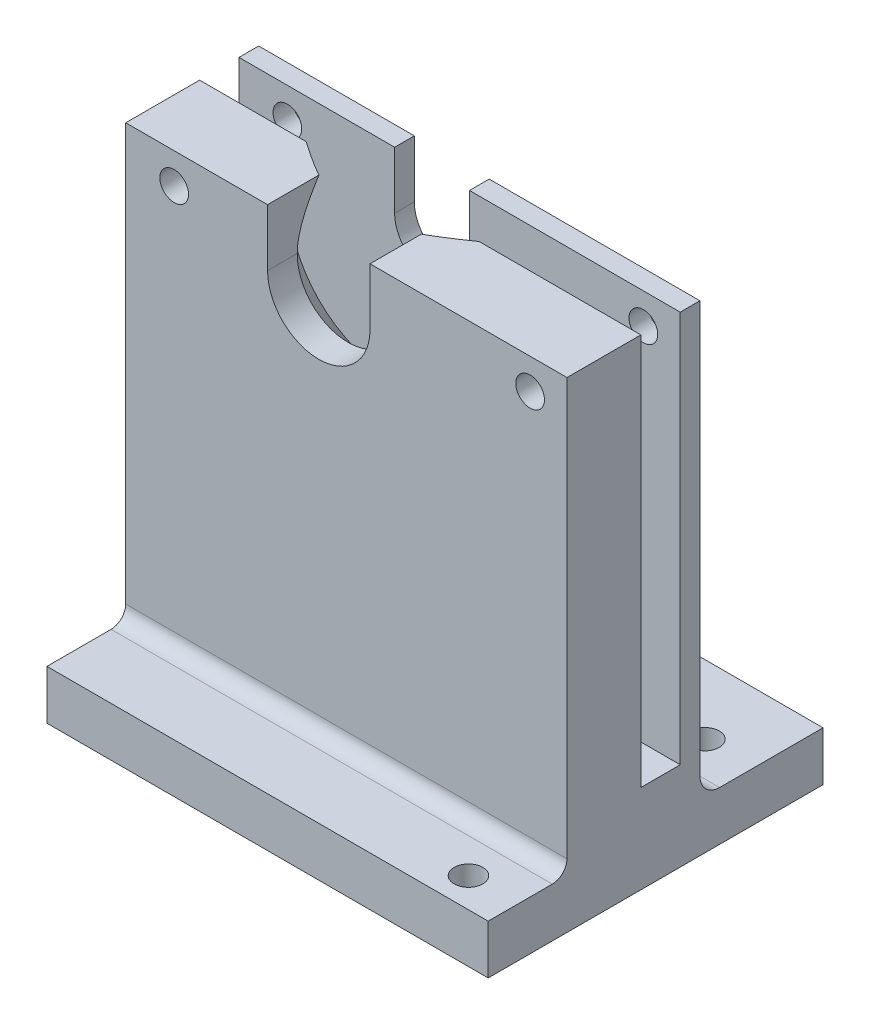
from build123d import *

# Parameters (mm, degrees)
SKETCH1_W                       = 56.896
SKETCH1_H                       = 9.525
BOSS_EXTRUDE1_DEPTH             = 61.976
SKETCH2_R                       = 13.3985
CUT_EXTRUDE1_DEPTH              = 5.8801
CUT_EXTRUDE1_DRAFT              = -50
SKETCH5_W                       = 56.896
SKETCH5_H                       = 11.43
BOSS_EXTRUDE2_DEPTH             = 7.62
TAP_DRILL_FOR_M3X0_5_TAP3_D     = 2.5
TAP_DRILL_FOR_M3X0_5_TAP3_DEPTH = 25.4
TAP_DRILL_FOR_M3X0_5_TAP3_TIP   = 0.751075774
BOSS_EXTRUDE4_DEPTH             = 56.896
M3_CLEARANCE_HOLE3_D            = 3.7
M3_CLEARANCE_HOLE3_DEPTH        = 25.4
M3_CLEARANCE_HOLE3_TIP          = 1.111592145
SKETCH6_W                       = 56.896
SKETCH6_H                       = 2.54
BOSS_EXTRUDE5_DEPTH             = 50.546
SKETCH24_R                      = 4.826
CUT_EXTRUDE2_DEPTH              = 2.54
SKETCH25_R                      = 6.604
CUT_EXTRUDE3_DEPTH              = 7.366
M3_CLEARANCE_HOLE4_D            = 3.7
M3_CLEARANCE_HOLE4_DEPTH        = 17.272
M3_CLEARANCE_HOLE4_TIP          = 1.111592145


with BuildPart() as part:
    # Sketch1 → Boss-Extrude1 (new body)
    with BuildSketch(Plane(origin=(0, 0, 0), x_dir=(1, 0, 0), z_dir=(0, 1, 0))):
        with Locations((9.398, 0)):
            Rectangle(SKETCH1_W, SKETCH1_H)
    extrude(amount=BOSS_EXTRUDE1_DEPTH)


with BuildPart() as cut_extrude1_tool:
    # Sketch2 → Cut-Extrude1 (with draft: the straight prism first)
    with BuildSketch(Plane(origin=(0, 0, -4.7625), x_dir=(-1, 0, 0), z_dir=(0, 0, -1))):
        with Locations((-5.842, 54.552080914)):
            Circle(SKETCH2_R)
    extrude(amount=-CUT_EXTRUDE1_DEPTH)
    # Cut-Extrude1: the draft: its side faces are tilted about the plane it starts from
    cut_extrude1_sides = [cut_extrude1_tool.faces().sort_by_distance(p)[0] for p in [
        (19.2405, 54.552080914, -1.82245),
    ]]
    draft(cut_extrude1_sides, Plane(origin=(0, 0, -4.7625), x_dir=(-1, 0, 0), z_dir=(0, 0, -1)), CUT_EXTRUDE1_DRAFT)


with BuildPart() as part_1:
    add(part.part)

    # Cut-Extrude1: cut by cut_extrude1_tool
    add(cut_extrude1_tool.part, mode=Mode.SUBTRACT)

    # Sketch5 → Boss-Extrude2 (add)
    with BuildSketch(Plane(origin=(0, 0, -4.7625), x_dir=(-1, 0, 0), z_dir=(0, 0, -1))):
        with Locations((-9.398, 5.715)):
            Rectangle(SKETCH5_W, SKETCH5_H)
    extrude(amount=BOSS_EXTRUDE2_DEPTH)

    # Tap Drill for M3x0.5 Tap3
    with Locations(Plane(origin=(0, 11.43, 0), x_dir=(1, 0, 0), z_dir=(0, 1, 0))):
        with Locations((31.496, 7.3025)):
            Hole(TAP_DRILL_FOR_M3X0_5_TAP3_D / 2, depth=TAP_DRILL_FOR_M3X0_5_TAP3_DEPTH)
            with Locations((0, 0, -(TAP_DRILL_FOR_M3X0_5_TAP3_DEPTH + TAP_DRILL_FOR_M3X0_5_TAP3_TIP / 2))):  # 118° drill point
                Cone(0, TAP_DRILL_FOR_M3X0_5_TAP3_D / 2, TAP_DRILL_FOR_M3X0_5_TAP3_TIP, mode=Mode.SUBTRACT)

    # Sketch19 → Boss-Extrude4 (add)
    with BuildSketch(Plane(origin=(37.846, 0, 0), x_dir=(0, 0, -1), z_dir=(1, 0, 0))):
        with BuildLine():
            Line((12.3825, 8.89), (12.3825, 0))
            Line((12.3825, 0), (28.2575, 0))
            Line((28.2575, 0), (28.2575, 6.35))
            Line((28.2575, 6.35), (14.9225, 6.35))
            ThreePointArc((14.9225, 6.35), (13.126448776, 7.093948776), (12.3825, 8.89))
        make_face()
        with BuildLine():
            Line((-14.9225, 0), (-4.7625, 0))
            Line((-4.7625, 0), (-4.7625, 8.2423))
            ThreePointArc((-4.7625, 8.2423), (-5.316741838, 6.904241838), (-6.6548, 6.35))
            Line((-6.6548, 6.35), (-14.9225, 6.35))
            Line((-14.9225, 6.35), (-14.9225, 0))
        make_face()
    extrude(amount=-BOSS_EXTRUDE4_DEPTH)

    # M3 Clearance Hole3
    with Locations(Plane(origin=(0, 0, 0), x_dir=(-1, 0, 0), z_dir=(0, -1, 0))):
        with Locations((-31.496, -11.1125), (-31.496, 19.3675)):
            Hole(M3_CLEARANCE_HOLE3_D / 2, depth=M3_CLEARANCE_HOLE3_DEPTH)
            with Locations((0, 0, -(M3_CLEARANCE_HOLE3_DEPTH + M3_CLEARANCE_HOLE3_TIP / 2))):  # 118° drill point
                Cone(0, M3_CLEARANCE_HOLE3_D / 2, M3_CLEARANCE_HOLE3_TIP, mode=Mode.SUBTRACT)

    # Sketch6 → Boss-Extrude5 (add)
    with BuildSketch(Plane(origin=(0, 11.43, 0), x_dir=(1, 0, 0), z_dir=(0, 1, 0))):
        with Locations((9.398, 11.1125)):
            Rectangle(SKETCH6_W, SKETCH6_H)
    extrude(amount=BOSS_EXTRUDE5_DEPTH)

    # Sketch24 → Cut-Extrude2 (cut)
    with BuildSketch(Plane(origin=(0, 0, -12.3825), x_dir=(-1, 0, 0), z_dir=(0, 0, -1))):
        with BuildLine():
            ThreePointArc((-10.668, 54.61), (-5.842, 59.436), (-1.016, 54.61))
            Line((-1.016, 54.61), (-1.016, 61.976))
            Line((-1.016, 61.976), (-10.668, 61.976))
            Line((-10.668, 61.976), (-10.668, 54.61))
        make_face()
        with Locations((-5.842, 54.61)):
            Circle(SKETCH24_R)
    extrude(amount=-CUT_EXTRUDE2_DEPTH, mode=Mode.SUBTRACT)

    # Sketch25 → Cut-Extrude3 (cut)
    with BuildSketch(Plane.XY.offset(4.7625)):
        with BuildLine():
            ThreePointArc((-0.762, 54.61), (5.842, 61.214), (12.446, 54.61))
            Line((12.446, 54.61), (12.446, 61.976))
            Line((12.446, 61.976), (-0.762, 61.976))
            Line((-0.762, 61.976), (-0.762, 54.61))
        make_face()
        with Locations((5.842, 54.61)):
            Circle(SKETCH25_R)
    extrude(amount=-CUT_EXTRUDE3_DEPTH, mode=Mode.SUBTRACT)

    # M3 Clearance Hole4
    with Locations(Plane(origin=(0, 0, -12.3825), x_dir=(-1, 0, 0), z_dir=(0, 0, -1))):
        with Locations((-33.09066659, 58.02989171), (12.806122092, 58.02989171)):
            Hole(M3_CLEARANCE_HOLE4_D / 2, depth=M3_CLEARANCE_HOLE4_DEPTH)
            with Locations((0, 0, -(M3_CLEARANCE_HOLE4_DEPTH + M3_CLEARANCE_HOLE4_TIP / 2))):  # 118° drill point
                Cone(0, M3_CLEARANCE_HOLE4_D / 2, M3_CLEARANCE_HOLE4_TIP, mode=Mode.SUBTRACT)


solid = part_1.part
